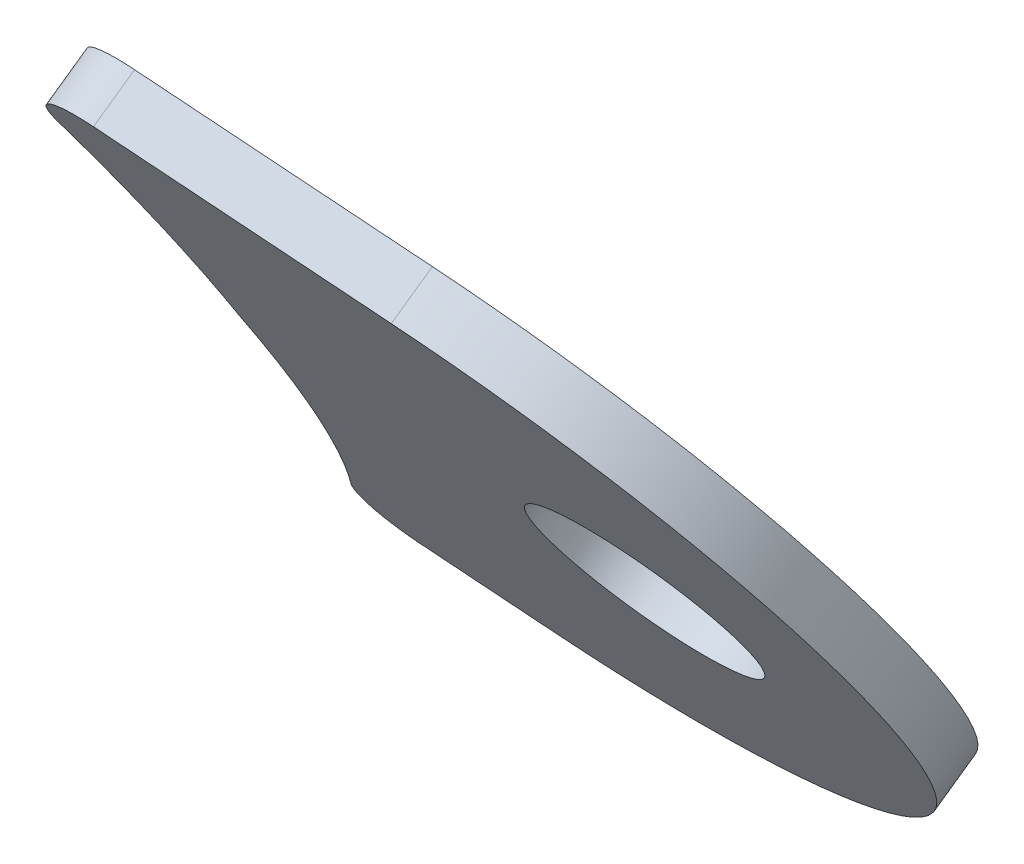
from build123d import *

# Parameters (mm, degrees)
SKETCH1_R           = 3.3019999999999836
BOSS_EXTRUDE1_DEPTH = 1.5875
SKETCH2_R           = 12.7
CUT_EXTRUDE2_DEPTH  = 146.57558110485613
CUT_EXTRUDE3_DEPTH  = 400.917308055041
CUT_EXTRUDE4_DEPTH  = 400.91690405439095
FILLET1_R           = 1.5875


with BuildPart() as part:
    # Sketch1 → Boss-Extrude1 (new body)
    with BuildSketch(Plane(origin=(4.715e-14, 220.81273991226263, -315.3532743689599), x_dir=(-1, 7e-17, -1e-16), z_dir=(0, 0.5735764363510497, -0.8191520442889892))):
        with BuildLine():
            Line((-352.9368830837315, 115.82645369700992), (-375.29590907686907, 107.8750150529707))
            ThreePointArc((-375.29590907686907, 107.8750150529707), (-383.0064063960404, 91.65378726062865), (-366.7851786036984, 83.94328994145738))
            Line((-366.7851786036984, 83.94328994145738), (-352.9368830837315, 88.86809624497586))
            Line((-352.9368830837315, 88.86809624497586), (-352.9368830837315, 115.82645369700992))
        make_face()
        with Locations(Location((-375.5277422986924, 94.31339053349453, 0), (0, 0, 90))):
            Circle(SKETCH1_R, mode=Mode.SUBTRACT)
    extrude(amount=BOSS_EXTRUDE1_DEPTH)

    # Sketch2 → Cut-Extrude2 (cut, through all)
    with BuildSketch(Plane(origin=(364.35174229869244, 343.62540364794484, -135.39966553044988), x_dir=(-0.9960075449626111, 0.027318171664055604, 0.08498639817338811), z_dir=(-0.0892690897094424, -0.3047987291070713, -0.9482240053685426))):
        with Locations((-0.03783689084002617, -0.5075300251178305)):
            Circle(SKETCH2_R)
    extrude(amount=CUT_EXTRUDE2_DEPTH, mode=Mode.SUBTRACT)

    # Sketch3 → Cut-Extrude3 (cut, through all)
    with BuildSketch(Plane(origin=(4.734e-14, 221.72329250496995, -316.65367823926863), x_dir=(-1, 7e-17, -1e-16), z_dir=(0, 0.5735764363510497, -0.8191520442889892))):
        with BuildLine():
            Line((-361.4453353005722, 85.84227411038414), (-360.53395932333007, 86.16638260092915))
            Line((-360.53395932333007, 86.16638260092915), (-363.80419645721065, 111.96176050593412))
            add(Edge.make_bspline(
                [(-363.80419645721065, 111.96176050593412), (-368.8920523914014, 98.57905697453593), (-361.4453353005722, 85.84227411038414)],
                knots=[0.8633594194263924, 0.8633594194263924, 0.8633594194263924, 2.2053014206357777, 2.2053014206357777, 2.2053014206357777], degree=2, weights=[1, 0.7832183186966504, 1]))
        make_face()
    extrude(amount=-CUT_EXTRUDE3_DEPTH, mode=Mode.SUBTRACT)

    # Sketch5 → Cut-Extrude4 (cut, through all)
    with BuildSketch(Plane(origin=(4.715e-14, 220.81273991226263, -315.3532743689599), x_dir=(1, -7e-17, 1e-16), z_dir=(0, -0.5735764363510497, 0.8191520442889892))):
        with BuildLine():
            Line((364.81964209388303, 111.600642196092), (363.80419645721065, 111.96176050593412))
            Line((363.80419645721065, 111.96176050593412), (365.40184998669423, 99.04304749276544))
            add(Edge.make_bspline(
                [(365.40184998669423, 99.04304749276544), (366.3557730480568, 105.71124194209018), (364.81964209388303, 111.600642196092)],
                knots=[4.662458191197461, 4.662458191197461, 4.662458191197461, 5.280973611848554, 5.280973611848554, 5.280973611848554], degree=2, weights=[1, 0.9525597493758428, 1]))
        make_face()
    extrude(amount=-CUT_EXTRUDE4_DEPTH, mode=Mode.SUBTRACT)

    # Fillet1
    fillet1_edges = [part.edges().sort_by_distance(p)[0] for p in [
        (361.44533530057225, 291.5858905325532, -266.76637063161013),
        (364.8196420938831, 312.685910407509, -251.99197765879123),
    ]]
    fillet(fillet1_edges, radius=FILLET1_R)


solid = part.part
